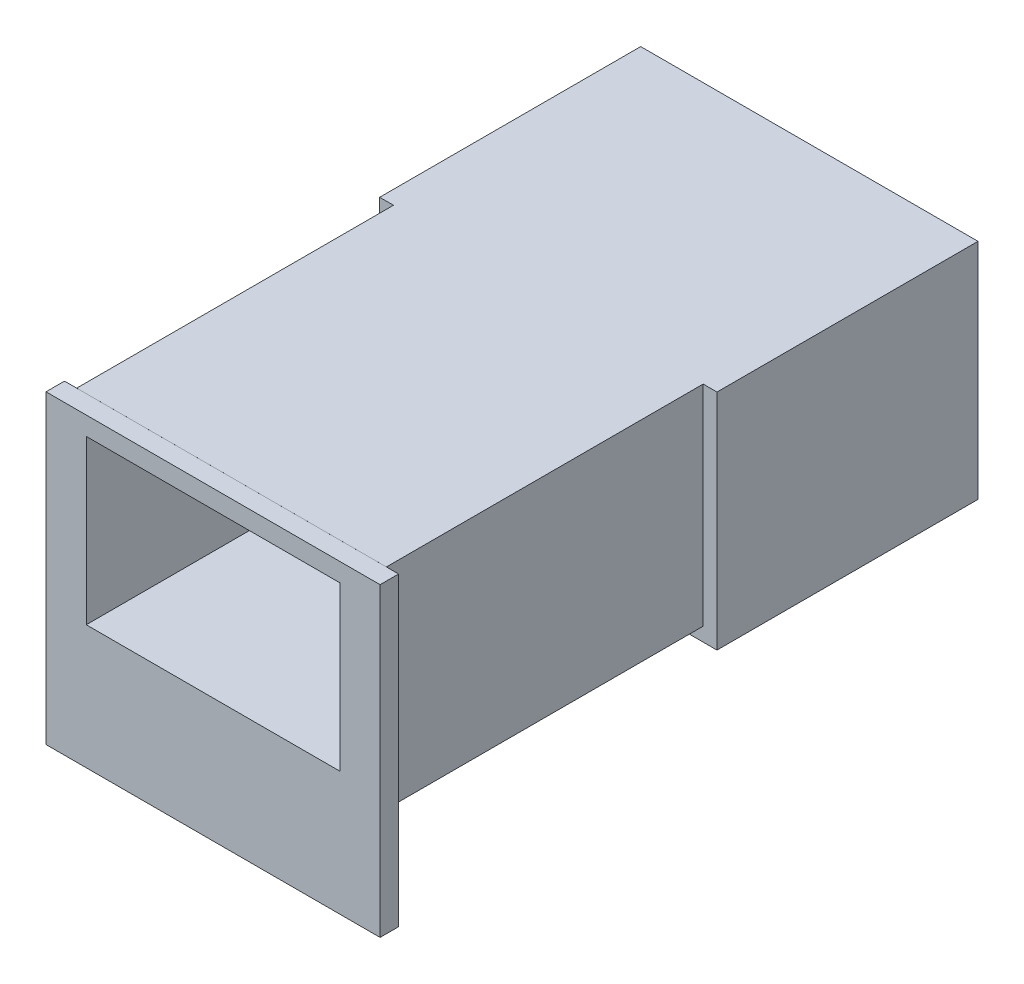
from build123d import *

# Parameters (mm, degrees)
CROQUIS1_W               = 53.24
CROQUIS1_H               = 35.28
CROQUIS1_W_2             = 46.88
CROQUIS1_H_2             = 29.18
SALIENTE_EXTRUIR2_DEPTH  = 41.2
CROQUIS3_W               = 48.88
CROQUIS3_H               = 33.1
CROQUIS3_W_2             = 40.02
CROQUIS3_H_2             = 25.75
SALIENTE_EXTRUIR11_DEPTH = 50
CROQUIS15_W              = 52.73
CROQUIS15_H              = 48.22
CROQUIS15_W_2            = 40.02
CROQUIS15_H_2            = 25.75
SALIENTE_EXTRUIR13_DEPTH = 2.92


with BuildPart() as part:
    # Croquis1 → Saliente-Extruir2 (new body)
    with BuildSketch(Plane.XY):
        with Locations((-10.511813518, 0.307314635)):
            Rectangle(CROQUIS1_W, CROQUIS1_H)
        with Locations((-10.511813518, 0.437314635)):
            Rectangle(CROQUIS1_W_2, CROQUIS1_H_2, mode=Mode.SUBTRACT)
    extrude(amount=SALIENTE_EXTRUIR2_DEPTH)

    # Croquis3 → Saliente-Extruir11 (add)
    with BuildSketch(Plane.XY.offset(41.2)):
        with Locations((-10.511813518, 1.397314635)):
            Rectangle(CROQUIS3_W, CROQUIS3_H)
        with Locations((-10.511813518, 2.152314635)):
            Rectangle(CROQUIS3_W_2, CROQUIS3_H_2, mode=Mode.SUBTRACT)
    extrude(amount=SALIENTE_EXTRUIR11_DEPTH)

    # Croquis15 → Saliente-Extruir13 (add)
    with BuildSketch(Plane.XY.offset(91.2)):
        with Locations((-10.511813518, -6.164685365)):
            Rectangle(CROQUIS15_W, CROQUIS15_H)
        with Locations((-10.511813518, 2.152314635)):
            Rectangle(CROQUIS15_W_2, CROQUIS15_H_2, mode=Mode.SUBTRACT)
    extrude(amount=SALIENTE_EXTRUIR13_DEPTH)


solid = part.part
